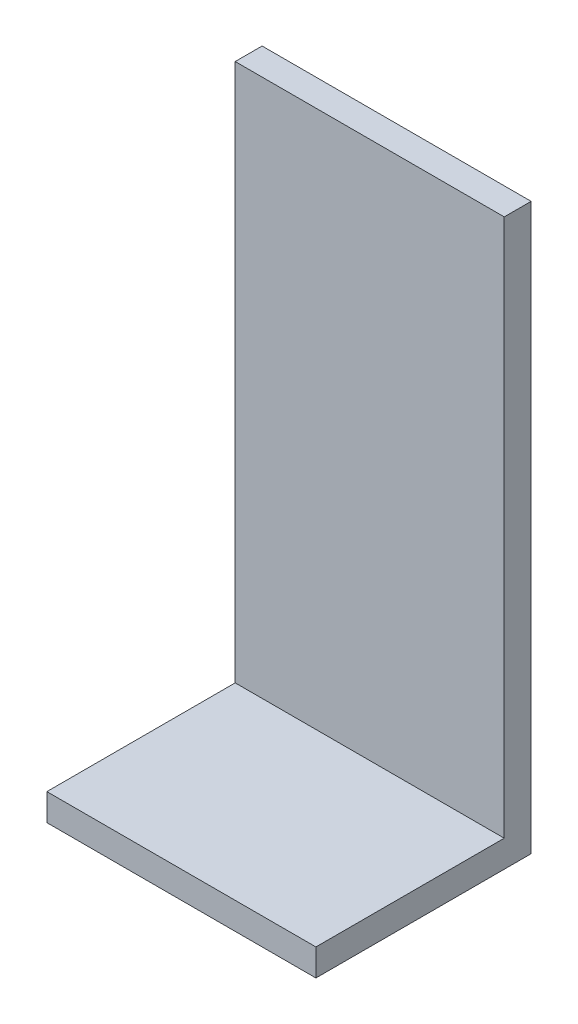
from build123d import *

# Parameters (mm, degrees)
SKETCH1_W           = 31.75
SKETCH1_H           = 63.5
BOSS_EXTRUDE1_DEPTH = 3.175
SKETCH1_3_W         = 31.75
SKETCH1_3_H         = 3.175
BOSS_EXTRUDE2_DEPTH = 25.4


with BuildPart() as part:
    # Sketch1 → Boss-Extrude1 (new body)
    with BuildSketch(Plane.XY):
        with Locations((15.875, 31.75)):
            Rectangle(SKETCH1_W, SKETCH1_H)
    extrude(amount=BOSS_EXTRUDE1_DEPTH)

    # Sketch1<3> → Boss-Extrude2 (add)
    with BuildSketch(Plane.XY):
        with Locations((15.875, -1.5875)):
            Rectangle(SKETCH1_3_W, SKETCH1_3_H)
    extrude(amount=BOSS_EXTRUDE2_DEPTH)


solid = part.part
